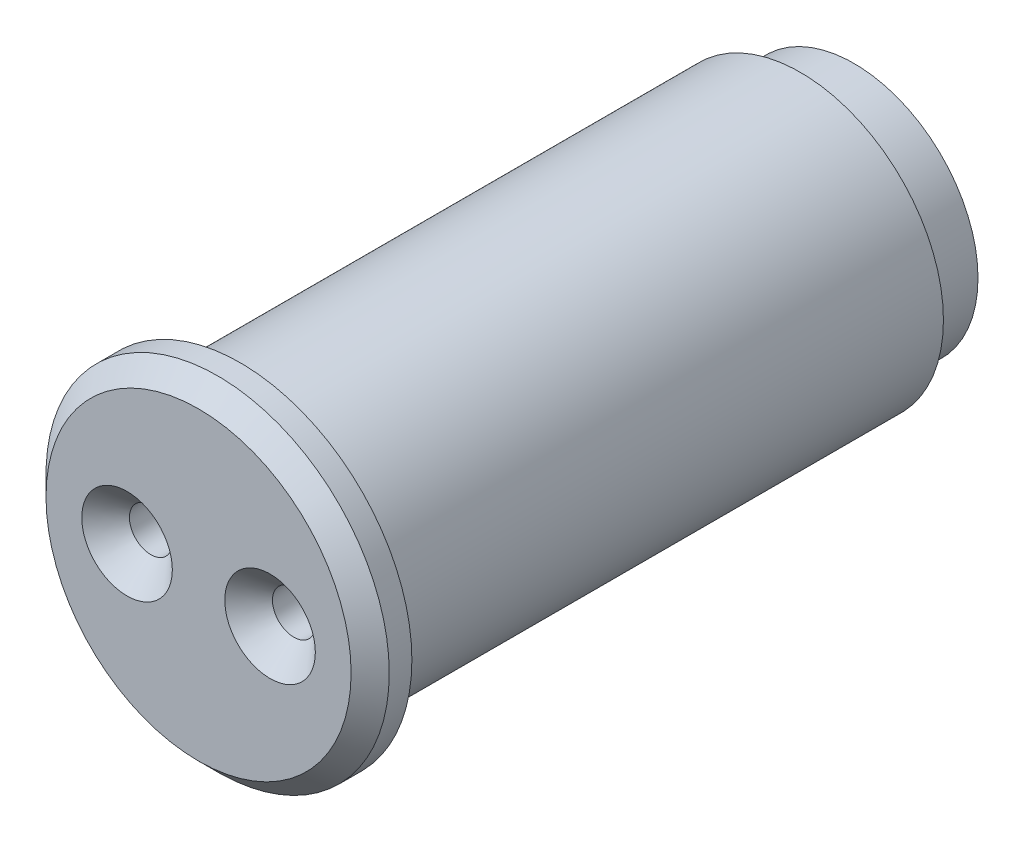
from build123d import *

# Parameters (mm, degrees)
SKETCH_1_R          = 5.2
EXTRUDE_1_DEPTH     = 27.5
SKETCH_6_R          = 7.2
EXTRUDE_3_DEPTH     = 1.75
SKETCH_8_R          = 6
EXTRUDE_4_DEPTH     = 23.5
SKETCH_3_R          = 0.85
CUT_EXTRUDE_4_DEPTH = 8
SKETCH_7_R          = 0.9
CUT_EXTRUDE_5_DEPTH = 8
CHAMFER_1_SIZE      = 1
CHAMFER_2_SIZE      = 1
SKETCH_9_R          = 0.493863849
CUT_EXTRUDE_6_DEPTH = 1
CHAMFER_3_SIZE      = 0.8


with BuildPart() as part:
    # 草图1 → 凸台-拉伸1 (new body)
    with BuildSketch(Plane.XY):
        Circle(SKETCH_1_R)
    extrude(amount=EXTRUDE_1_DEPTH)

    # 草图6 → 凸台-拉伸3 (add)
    with BuildSketch(Plane.XY.offset(27.5)):
        Circle(SKETCH_6_R)
    extrude(amount=-EXTRUDE_3_DEPTH)

    # 草图8 → 凸台-拉伸4 (add)
    with BuildSketch(Plane(origin=(0, 0, 25.75), x_dir=(-1, 0, 0), z_dir=(0, 0, -1))):
        with Locations(Location((0, 0, 0), (0, 0, 180))):
            Circle(SKETCH_8_R)
    extrude(amount=EXTRUDE_4_DEPTH)

    # 草图3 → 切除-拉伸4 (cut)
    with BuildSketch(Plane.XY.offset(27.5)):
        with Locations((-3, 0)):
            Circle(SKETCH_3_R)
        with Locations((3, 0)):
            Circle(SKETCH_3_R)
    cut_extrude_4 = extrude(amount=-CUT_EXTRUDE_4_DEPTH, mode=Mode.SUBTRACT)

    # 镜向3: 切除-拉伸4 across plane
    add(cut_extrude_4.mirror(Plane.XY.offset(13.75)), mode=Mode.SUBTRACT)

    # 草图7 → 切除-拉伸5 (cut)
    with BuildSketch(Plane.XY.offset(27.5)):
        with Locations((-3, 0)):
            Circle(SKETCH_7_R)
        with Locations((3, 0)):
            Circle(SKETCH_7_R)
    extrude(amount=-CUT_EXTRUDE_5_DEPTH, mode=Mode.SUBTRACT)

    # 倒角1
    chamfer_1_edges = [part.edges().sort_by_distance(p)[0] for p in [
        (-3.85, 0, 0),
        (2.15, 0, 0),
    ]]
    chamfer(chamfer_1_edges, length=CHAMFER_1_SIZE)

    # 倒角2
    chamfer_2_edges = [part.edges().sort_by_distance(p)[0] for p in [
        (-3.9, 0, 27.5),
        (2.1, 0, 27.5),
    ]]
    chamfer(chamfer_2_edges, length=CHAMFER_2_SIZE)

    # 草图9 → 切除-拉伸6 (cut)
    with BuildSketch(Plane(origin=(0, 0, 0), x_dir=(-1, 0, 0), z_dir=(0, 0, -1))):
        with Locations((-1.600597529, 2.951921672)):
            Circle(SKETCH_9_R)
        with Locations(Location((1.529748789, 2.989251185, 0), (0, 0, 180))):
            Circle(SKETCH_9_R)
        with Locations((1.600597529, -2.951921672)):
            Circle(SKETCH_9_R)
        with Locations(Location((-1.529748789, -2.989251185, 0), (0, 0, 180))):
            Circle(SKETCH_9_R)
    extrude(amount=-CUT_EXTRUDE_6_DEPTH, mode=Mode.SUBTRACT)

    # 倒角3
    chamfer_3_edges = [part.edges().sort_by_distance(p)[0] for p in [
        (-7.2, 0, 27.5),
    ]]
    chamfer(chamfer_3_edges, length=CHAMFER_3_SIZE)


solid = part.part
